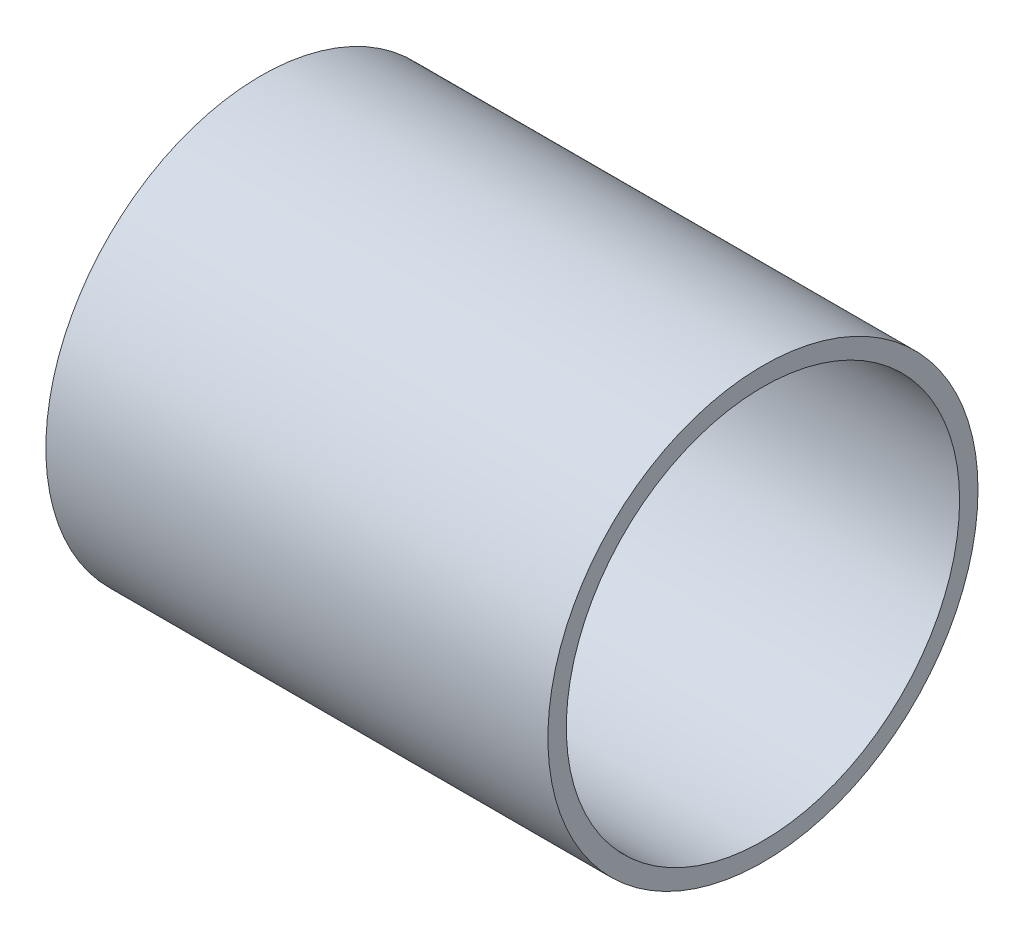
from build123d import *

# Parameters (mm, degrees)
SKETCH_1_R      = 12.85
SKETCH_1_R_2    = 11.75
EXTRUDE_1_DEPTH = 30


with BuildPart() as part:
    # Эскиз1 → Бобышка-Вытянуть1 (new body)
    with BuildSketch(Plane(origin=(0, 0, 0), x_dir=(0, 0, -1), z_dir=(1, 0, 0))):
        Circle(SKETCH_1_R)
        Circle(SKETCH_1_R_2, mode=Mode.SUBTRACT)
    extrude(amount=EXTRUDE_1_DEPTH)


solid = part.part
